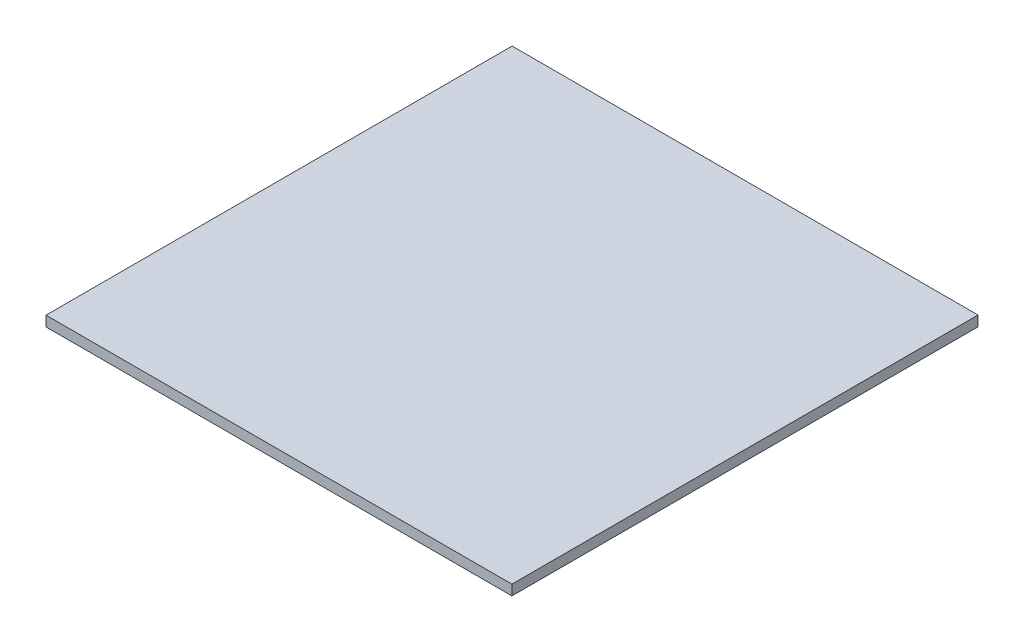
from build123d import *

# Parameters (mm, degrees)
SKETCH1_W           = 289.535287593
SKETCH1_H           = 289.663024438
BOSS_EXTRUDE1_DEPTH = 6.359632809


with BuildPart() as part:
    # Sketch1 → Boss-Extrude1 (new body)
    with BuildSketch(Plane(origin=(0, 0, 0), x_dir=(1, 0, 0), z_dir=(0, 1, 0))):
        with Locations((115.410917728, 113.195148432)):
            Rectangle(SKETCH1_W, SKETCH1_H)
    extrude(amount=BOSS_EXTRUDE1_DEPTH)


solid = part.part
